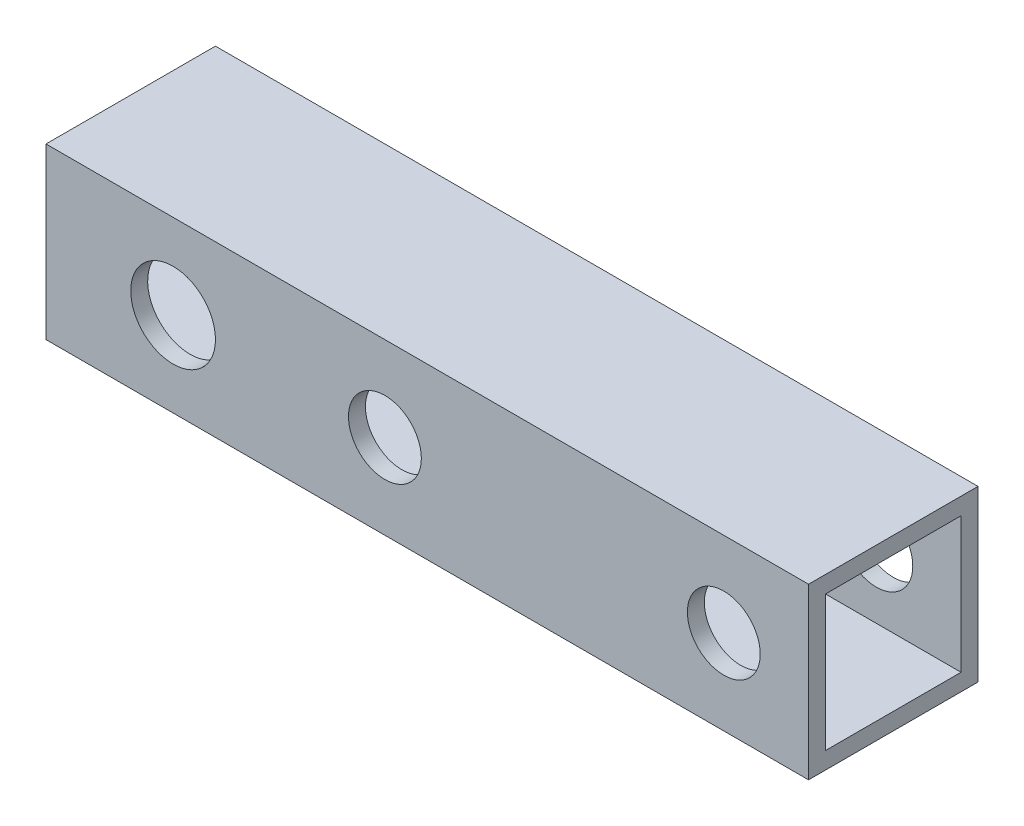
from build123d import *

# Parameters (mm, degrees)
SKETCH_1_W          = 10
SKETCH_1_H          = 10
SKETCH_1_W_2        = 8
SKETCH_1_H_2        = 8
EXTRUDE_1_DEPTH     = 45
SKETCH_2_R          = 2.15
SKETCH_2_R_2        = 2.5
CUT_EXTRUDE_1_DEPTH = 47.368092477


with BuildPart() as part:
    # ｽｹｯﾁ1 → 押し出し-薄板1 (new body)
    with BuildSketch(Plane(origin=(0, 0, 0), x_dir=(0, 0, -1), z_dir=(1, 0, 0))):
        Rectangle(SKETCH_1_W, SKETCH_1_H)
        Rectangle(SKETCH_1_W_2, SKETCH_1_H_2, mode=Mode.SUBTRACT)
    extrude(amount=EXTRUDE_1_DEPTH)

    # ｽｹｯﾁ2 → ｶｯﾄ - 押し出し1 (cut, through all)
    with BuildSketch(Plane.XY.offset(5)):
        with Locations((40, 0)):
            Circle(SKETCH_2_R)
        with Locations((20, 0)):
            Circle(SKETCH_2_R)
        with Locations((7.5, 0)):
            Circle(SKETCH_2_R_2)
    extrude(amount=-CUT_EXTRUDE_1_DEPTH, mode=Mode.SUBTRACT)


solid = part.part
